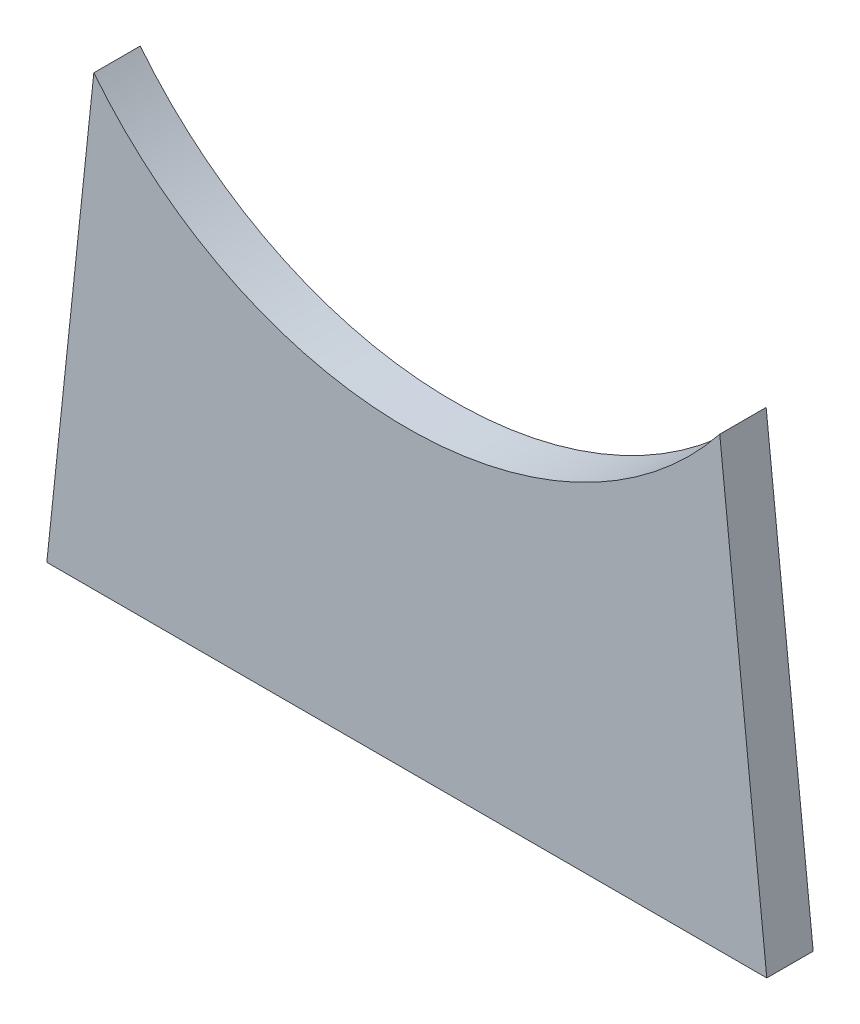
from build123d import *

# Parameters (mm, degrees)
BOSS_EXTRUDE1_DEPTH = 127.5


with BuildPart() as part:
    # Sketch1 → Boss-Extrude1 (new, symmetric)
    with BuildSketch(Plane.XY):
        with BuildLine():
            Line((-1978.1275, 0), (1978.1275, 0))
            Line((1978.1275, 0), (1719.702461541, 2458.75))
            ThreePointArc((1719.702461541, 2458.75), (0, 1628.426629626), (-1719.702461541, 2458.75))
            Line((-1719.702461541, 2458.75), (-1978.1275, 0))
        make_face()
    extrude(amount=BOSS_EXTRUDE1_DEPTH, both=True)


solid = part.part
